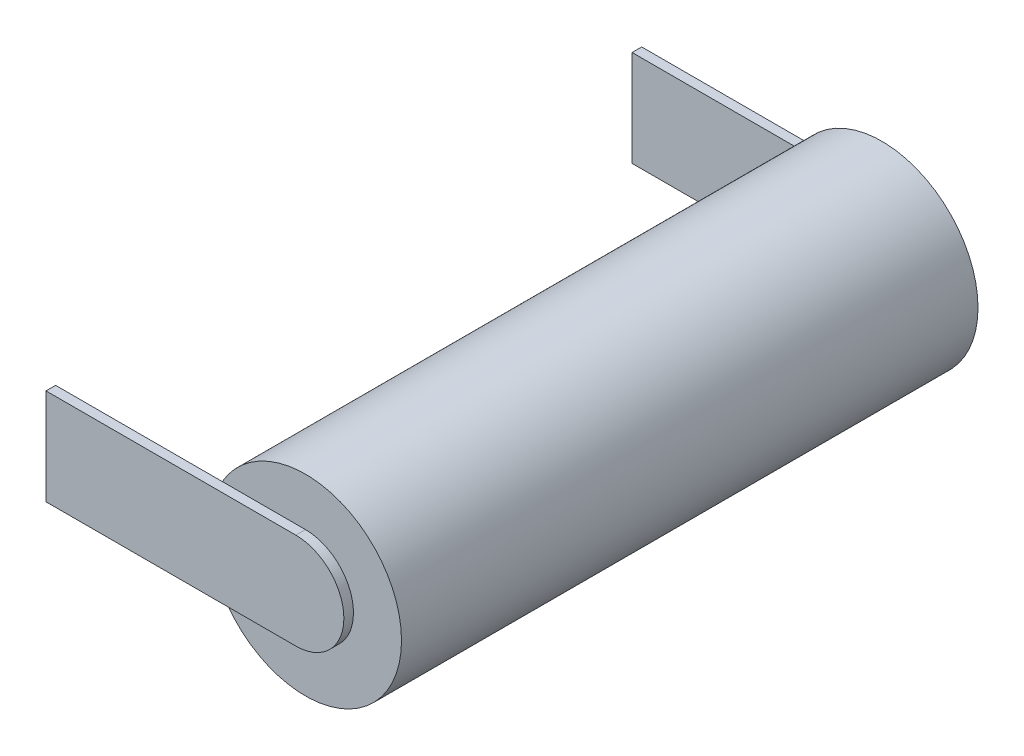
from build123d import *

# Parameters (mm, degrees)
SKETCH1_W           = 30
SKETCH1_H           = 5
BOSS_EXTRUDE1_START = 15
BOSS_EXTRUDE1_DEPTH = 0.5
BOSS_EXTRUDE2_START = -15.5
BOSS_EXTRUDE2_DEPTH = 0.5


with BuildPart() as part:
    # Sketch1 → Revolve1 (revolve)
    with BuildSketch(Plane(origin=(0, 0, 0), x_dir=(0, 0, -1), z_dir=(1, 0, 0)), mode=Mode.PRIVATE) as revolve1_sk:
        with Locations((0, 2.5)):
            Rectangle(SKETCH1_W, SKETCH1_H)
    revolve(revolve1_sk.sketch.rotate(Axis((0, 0, 15), (0, 0, -1)), 90), axis=Axis((0, 0, 15), (0, 0, -1)))

    # Sketch2 → Boss-Extrude1 (add)
    with BuildSketch(Plane.XY.offset(BOSS_EXTRUDE1_START)):
        with BuildLine():
            Line((-13, -2.5), (0, -2.5))
            ThreePointArc((0, -2.5), (2.5, 0), (0, 2.5))
            Line((0, 2.5), (-13, 2.5))
            Line((-13, 2.5), (-13, -2.5))
        make_face()
    extrude(amount=BOSS_EXTRUDE1_DEPTH)

    # Sketch2<2> → Boss-Extrude2 (add)
    with BuildSketch(Plane.XY.offset(BOSS_EXTRUDE2_START)):
        with BuildLine():
            Line((-13, -2.5), (0, -2.5))
            ThreePointArc((0, -2.5), (2.5, 0), (0, 2.5))
            Line((0, 2.5), (-13, 2.5))
            Line((-13, 2.5), (-13, -2.5))
        make_face()
    extrude(amount=BOSS_EXTRUDE2_DEPTH)


solid = part.part
